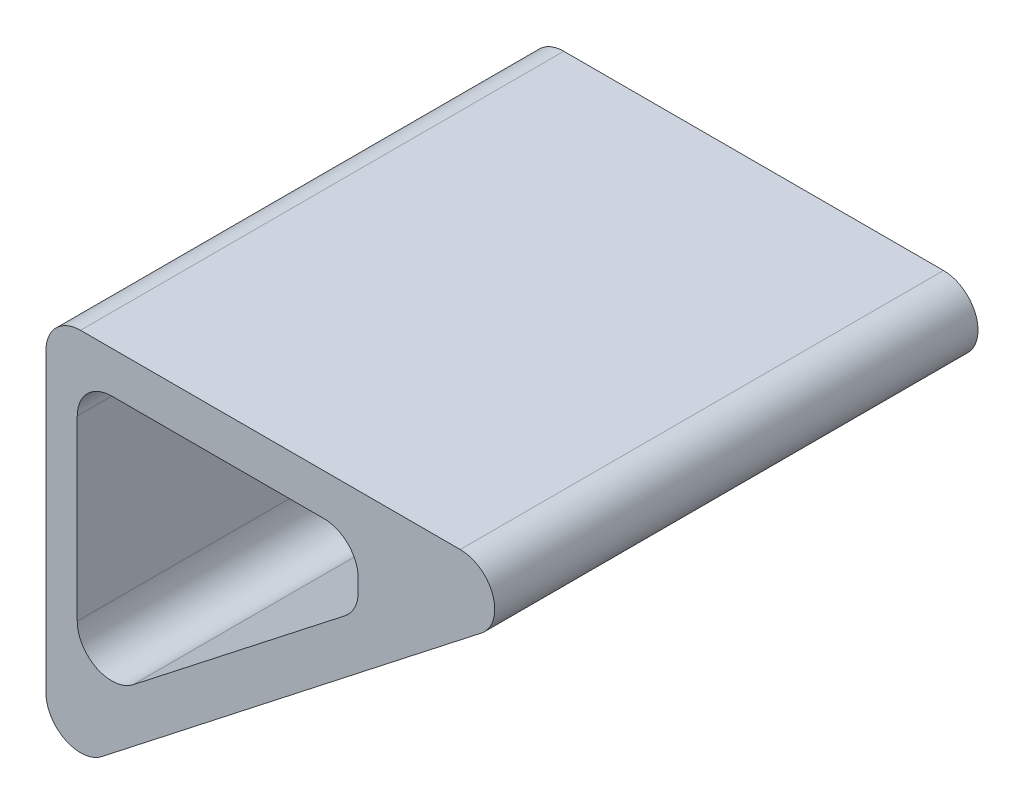
from build123d import *

# Parameters (mm, degrees)
BOSS_EXTRUDE1_DEPTH = 70


with BuildPart() as part:
    # Sketch2 → Boss-Extrude1 (new body)
    with BuildSketch(Plane.XY):
        with BuildLine():
            ThreePointArc((21.020681104, 22.985087501), (25.748004826, 19.613709748), (24.100290936, 14.04605167))
            Line((24.100290936, 14.04605167), (-30.899709064, -28.95394833))
            ThreePointArc((-30.899709064, -28.95394833), (-36.170431723, -29.509244994), (-38.979318896, -25.014912499))
            Line((-38.979318896, -25.014912499), (-38.979318896, 17.985087501))
            ThreePointArc((-38.979318896, 17.985087501), (-37.514852802, 21.520621407), (-33.979318896, 22.985087501))
            Line((-33.979318896, 22.985087501), (21.020681104, 22.985087501))
        make_face()
        with BuildLine():
            ThreePointArc((6.245861273, 11.998107897), (4.781395179, 15.533641803), (1.245861273, 16.998107897))
            Line((1.245861273, 16.998107897), (-29.453101677, 16.998107897))
            ThreePointArc((-29.453101677, 16.998107897), (-32.988635583, 15.533641803), (-34.453101677, 11.998107897))
            Line((-34.453101677, 11.998107897), (-34.453101677, -13.737840514))
            ThreePointArc((-34.453101677, -13.737840514), (-31.644214504, -18.232173009), (-26.373491845, -17.676876345))
            Line((-26.373491845, -17.676876345), (4.325471105, 6.324131052))
            ThreePointArc((4.325471105, 6.324131052), (5.740193768, 8.072054056), (6.245861273, 10.263166883))
            Line((6.245861273, 10.263166883), (6.245861273, 11.998107897))
        make_face(mode=Mode.SUBTRACT)
    extrude(amount=BOSS_EXTRUDE1_DEPTH)


solid = part.part
